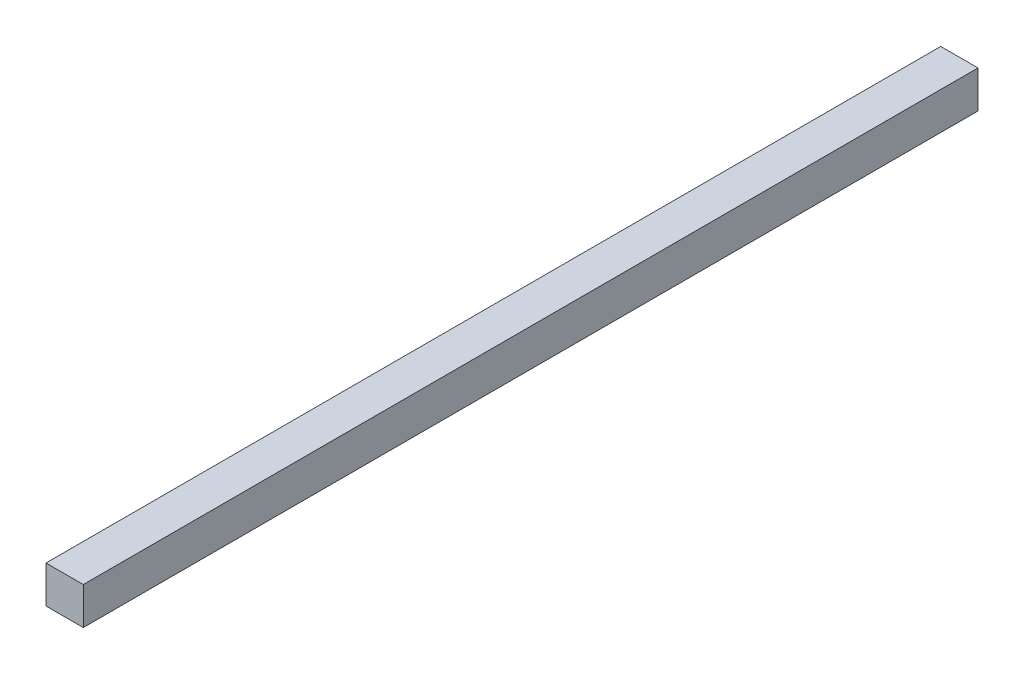
from build123d import *

# Parameters (mm, degrees)
SKETCH1_W           = 6.35
SKETCH1_H           = 6.35
BOSS_EXTRUDE1_DEPTH = 152.4


with BuildPart() as part:
    # Sketch1 → Boss-Extrude1 (new body)
    with BuildSketch(Plane.XY):
        Rectangle(SKETCH1_W, SKETCH1_H)
    extrude(amount=BOSS_EXTRUDE1_DEPTH)


solid = part.part
